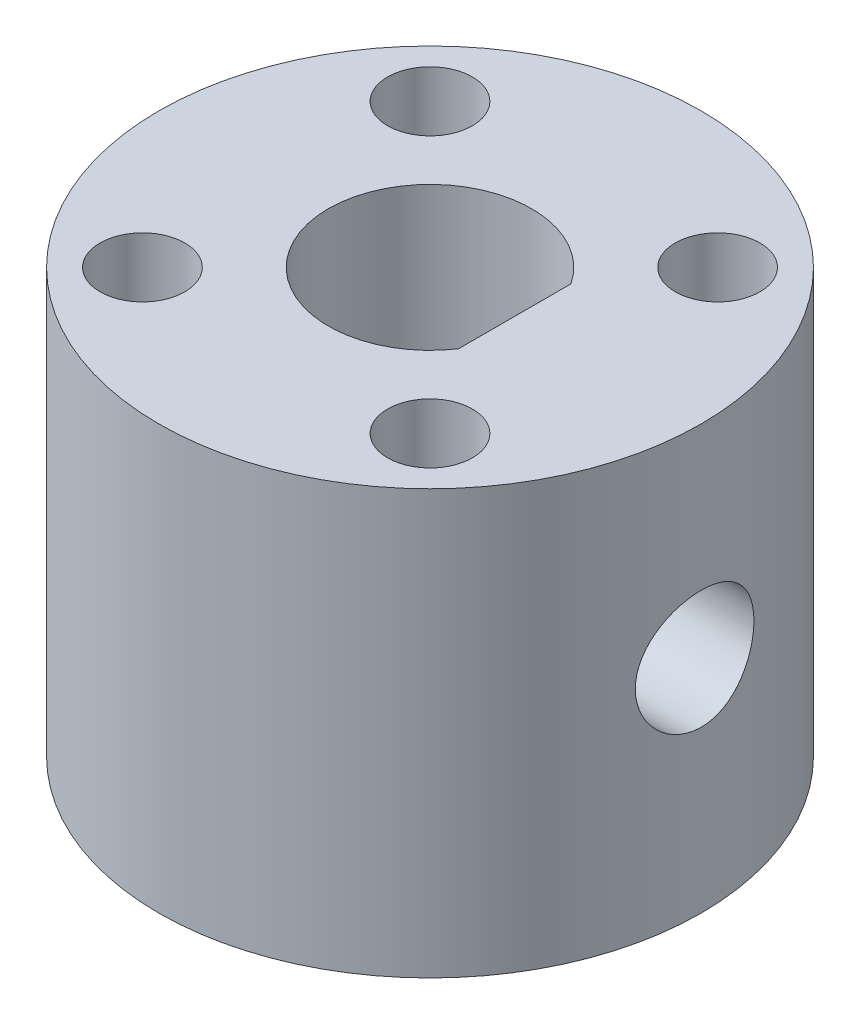
from build123d import *

# Parameters (mm, degrees)
SKETCH_1_R          = 8
SKETCH_1_R_2        = 1.25
EXTRUDE_1_DEPTH     = 12.5
SKETCH_3_R          = 1.75
CUT_EXTRUDE_1_DEPTH = 10


with BuildPart() as part:
    # 草图1 → 凸台-拉伸1 (new body)
    with BuildSketch(Plane(origin=(0, 0, 0), x_dir=(1, 0, 0), z_dir=(0, 1, 0))):
        with Locations(Location((0, 0, 0), (0, 0, 270))):
            Circle(SKETCH_1_R)
        with Locations(Location((4.242640687, 4.242640687, 0), (0, 0, 270))):
            Circle(SKETCH_1_R_2, mode=Mode.SUBTRACT)
        with Locations(Location((4.242640687, -4.242640687, 0), (0, 0, 270))):
            Circle(SKETCH_1_R_2, mode=Mode.SUBTRACT)
        with Locations(Location((-4.242640687, -4.242640687, 0), (0, 0, 270))):
            Circle(SKETCH_1_R_2, mode=Mode.SUBTRACT)
        with Locations(Location((-4.242640687, 4.242640687, 0), (0, 0, 270))):
            Circle(SKETCH_1_R_2, mode=Mode.SUBTRACT)
        with BuildLine():
            Line((2.5, 1.658312395), (2.5, -1.658312395))
            ThreePointArc((2.5, -1.658312395), (-3, 0), (2.5, 1.658312395))
        make_face(mode=Mode.SUBTRACT)
    extrude(amount=EXTRUDE_1_DEPTH)

    # 草图3 → 切除-拉伸1 (cut)
    with BuildSketch(Plane.ZY.offset(-2.5)):
        with Locations((0, 6.5)):
            Circle(SKETCH_3_R)
    extrude(amount=-CUT_EXTRUDE_1_DEPTH, mode=Mode.SUBTRACT)


solid = part.part
